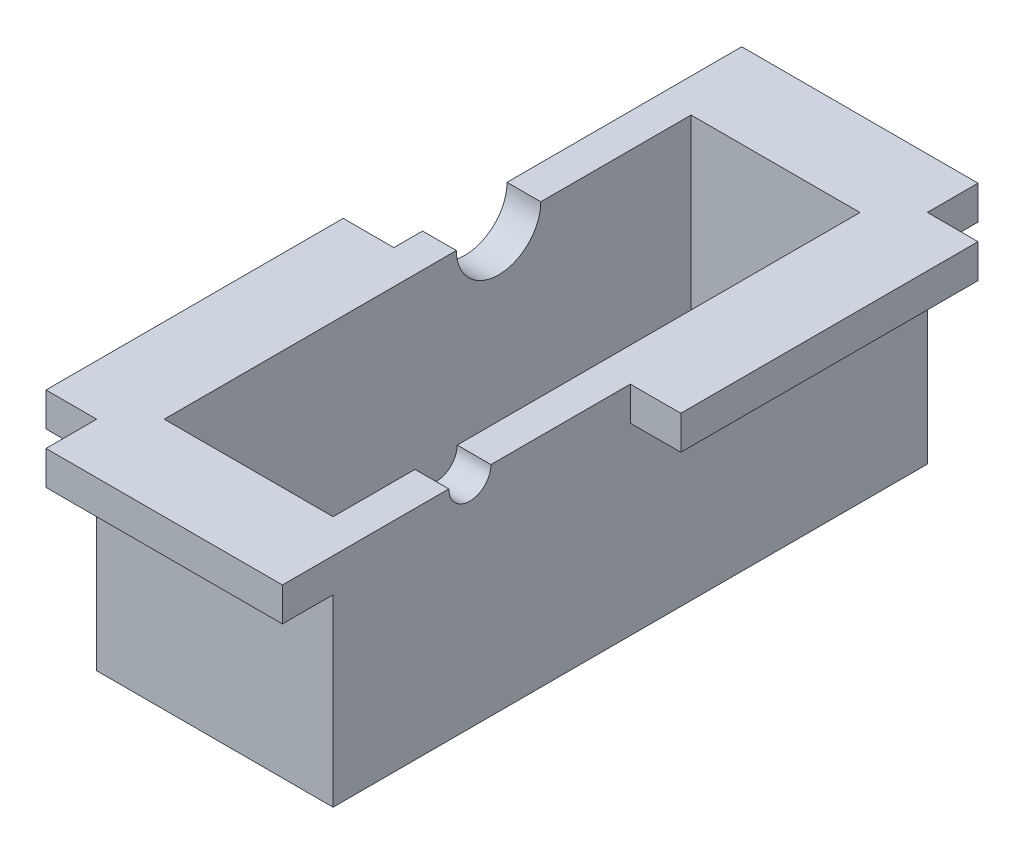
from build123d import *

# Parameters (mm, degrees)
SKETCH2_W           = 17.78
SKETCH2_H           = 44.704
SKETCH2_W_2         = 12.7
SKETCH2_H_2         = 39.624
BOSS_EXTRUDE3_DEPTH = 16.383
SKETCH4_W           = 12.7
SKETCH4_H           = 39.624
BOSS_EXTRUDE4_DEPTH = 1.27
SKETCH7_R           = 3.175
CUT_EXTRUDE1_DEPTH  = 4.318
SKETCH8_R           = 1.5875
CUT_EXTRUDE2_DEPTH  = 4.318
SKETCH9_W           = 17.767436789
SKETCH9_H           = 3.81
SKETCH9_W_2         = 3.81
SKETCH9_H_2         = 22.352
SKETCH9_W_3         = 17.78
BOSS_EXTRUDE5_DEPTH = 2.54


with BuildPart() as part:
    # Sketch2 → Boss-Extrude3 (new body)
    with BuildSketch(Plane(origin=(0, 0, 0), x_dir=(1, 0, 0), z_dir=(0, 1, 0))):
        Rectangle(SKETCH2_W, SKETCH2_H)
        Rectangle(SKETCH2_W_2, SKETCH2_H_2, mode=Mode.SUBTRACT)
    extrude(amount=BOSS_EXTRUDE3_DEPTH)

    # Sketch4 → Boss-Extrude4 (add)
    with BuildSketch(Plane.XZ):
        Rectangle(SKETCH4_W, SKETCH4_H)
    extrude(amount=-BOSS_EXTRUDE4_DEPTH)

    # Sketch7 → Cut-Extrude1 (cut)
    with BuildSketch(Plane.ZY.offset(8.89)):
        with Locations((-5.334, 16.383)):
            Circle(SKETCH7_R)
    extrude(amount=-CUT_EXTRUDE1_DEPTH, mode=Mode.SUBTRACT)

    # Sketch8 → Cut-Extrude2 (cut)
    with BuildSketch(Plane(origin=(8.89, 0, 0), x_dir=(0, 0, -1), z_dir=(1, 0, 0))):
        with Locations((-12.065, 16.383)):
            Circle(SKETCH8_R)
    extrude(amount=-CUT_EXTRUDE2_DEPTH, mode=Mode.SUBTRACT)

    # Sketch9 → Boss-Extrude5 (add)
    with BuildSketch(Plane(origin=(0, 16.383, 0), x_dir=(1, 0, 0), z_dir=(0, 1, 0))):
        with Locations((-0.006281605, 24.257)):
            Rectangle(SKETCH9_W, SKETCH9_H)
        with Locations((10.782436789, 11.176)):
            Rectangle(SKETCH9_W_2, SKETCH9_H_2)
        with Locations((0, -24.257)):
            Rectangle(SKETCH9_W_3, SKETCH9_H)
        with Locations((-10.795, -11.176)):
            Rectangle(SKETCH9_W_2, SKETCH9_H_2)
    extrude(amount=-BOSS_EXTRUDE5_DEPTH)


solid = part.part
